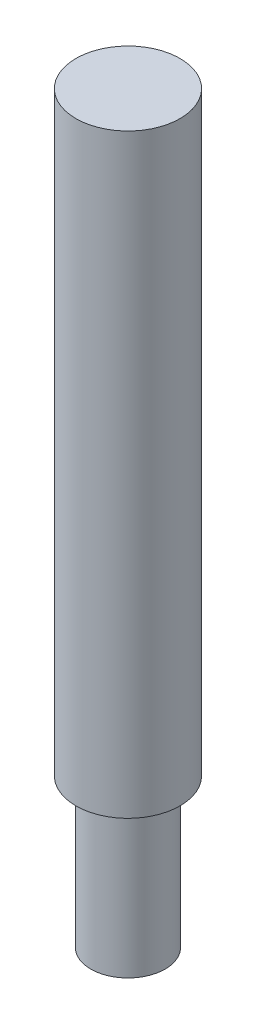
from build123d import *

# Parameters (mm, degrees)
SKETCH1_R           = 2.5
BOSS_EXTRUDE1_DEPTH = 10
SKETCH2_R           = 3.5
BOSS_EXTRUDE2_DEPTH = 40


with BuildPart() as part:
    # Sketch1 → Boss-Extrude1 (new body)
    with BuildSketch(Plane(origin=(0, 0, 0), x_dir=(1, 0, 0), z_dir=(0, 1, 0))):
        with Locations(Location((0, 0, 0), (0, 0, 270))):
            Circle(SKETCH1_R)
    extrude(amount=BOSS_EXTRUDE1_DEPTH)

    # Sketch2 → Boss-Extrude2 (add)
    with BuildSketch(Plane(origin=(0, 10, 0), x_dir=(1, 0, 0), z_dir=(0, 1, 0))):
        with Locations(Location((0, 0, 0), (0, 0, 270))):
            Circle(SKETCH2_R)
    extrude(amount=BOSS_EXTRUDE2_DEPTH)


solid = part.part
